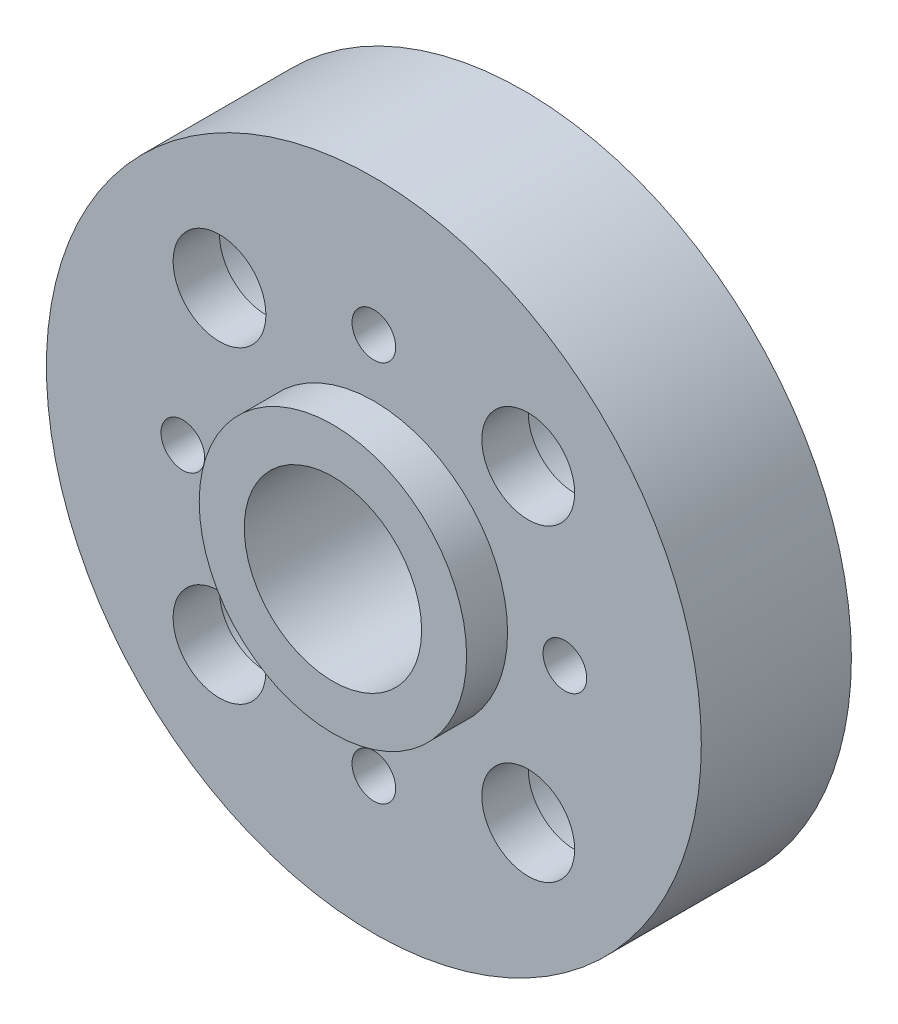
from build123d import *

# Parameters (mm, degrees)
D24_5_5_D6_5_2_R                = 12
D24_5_5_D6_5_2_R_2              = 3.25
D24_5_5_D6_5_DEPTH              = 5.5
EXTRUDE_START                   = 5.5
SKETCH_D9_8_1_5_R               = 4.9
SKETCH_D9_8_1_5_R_2             = 3.25
EXTRUDE_D9_8_1_5_DEPTH          = 1.5
F_4XD3_4_D5_8_PCD16_D           = 3.4
F_4XD3_4_D5_8_PCD16_CBORE_D     = 5.8
F_4XD3_4_D5_8_PCD16_CBORE_DEPTH = 3.8
SKETCH_1093_R                   = 10.05
CUT_EXTRUDE_D20_1_0_6_DEPTH     = 0.6
F_4XM2X0_4_PCD14_D              = 1.6


with BuildPart() as part:
    # D24__5.5__D6.5 2 → D24__5.5__D6.5 (new body)
    with BuildSketch(Plane.XY):
        Circle(D24_5_5_D6_5_2_R)
        Circle(D24_5_5_D6_5_2_R_2, mode=Mode.SUBTRACT)
    extrude(amount=D24_5_5_D6_5_DEPTH)

    # 轴承内孔定位台_D9.8_高1.5_截面 → 轴承内孔定位台_D9.8_高1.5 (add)
    with BuildSketch(Plane.XY.offset(EXTRUDE_START)):
        Circle(SKETCH_D9_8_1_5_R)
        Circle(SKETCH_D9_8_1_5_R_2, mode=Mode.SUBTRACT)
    extrude(amount=EXTRUDE_D9_8_1_5_DEPTH)

    # 轴承内圈_4xD3.4通孔_D5.8沉孔_PCD16 (through all)
    with Locations(Plane(origin=(5.656854249, -5.656854249, 0), x_dir=(-1, 0, 0), z_dir=(0, 0, -1))):
        with Locations((0, 0), (11.313708498, 0), (11.313708498, 11.313708498), (0, 11.313708498)):
            CounterBoreHole(F_4XD3_4_D5_8_PCD16_D / 2, F_4XD3_4_D5_8_PCD16_CBORE_D / 2, F_4XD3_4_D5_8_PCD16_CBORE_DEPTH)

    # Sketch 1093 → 原舵盘定位槽_D20.1_深0.6 (cut)
    with BuildSketch(Plane.XY):
        Circle(SKETCH_1093_R)
    extrude(amount=CUT_EXTRUDE_D20_1_0_6_DEPTH, mode=Mode.SUBTRACT)

    # 原舵盘_4xM2x0.4通螺纹_PCD14 (through all)
    with Locations(Plane(origin=(0, -7, 0.6), x_dir=(-1, 0, 0), z_dir=(0, 0, -1))):
        with Locations((0, 0), (7, 7), (0, 14), (-7, 7)):
            Hole(F_4XM2X0_4_PCD14_D / 2)


solid = part.part
